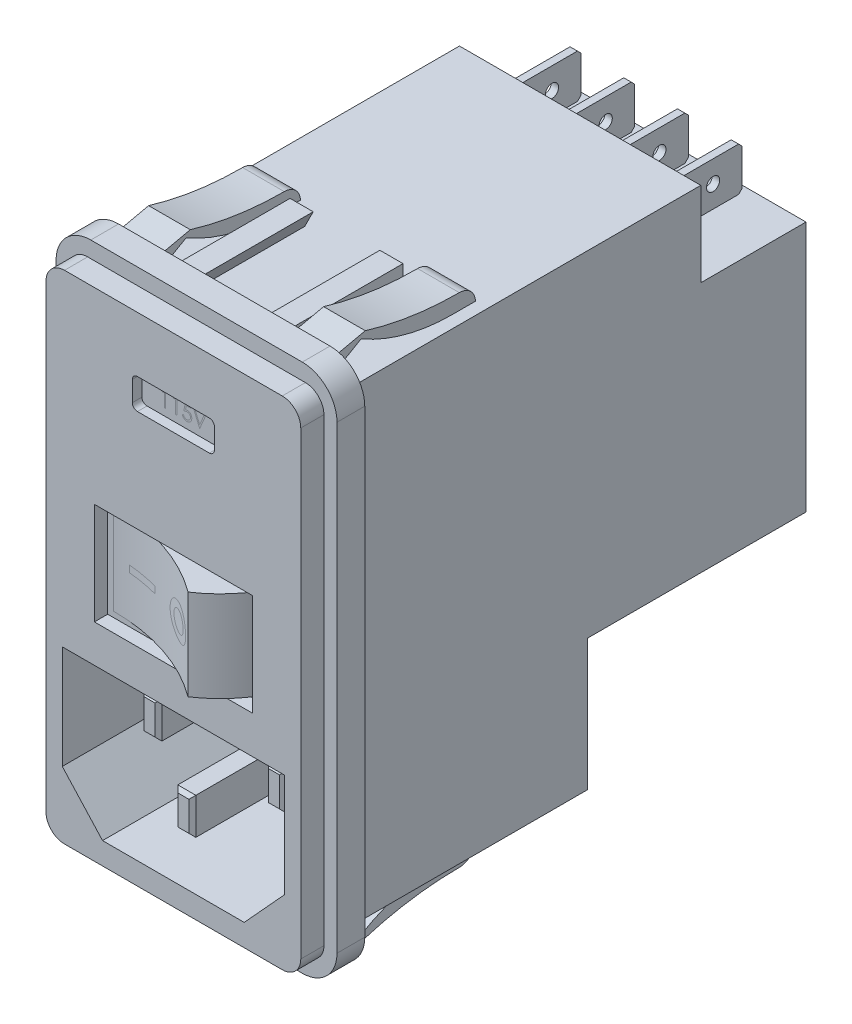
from build123d import *

# Parameters (mm, degrees)
BOSS_EXTRUDE1_DEPTH      = 5.588
CUT_EXTRUDE1_DEPTH       = 2.54
SKETCH4_W                = 26.4795
SKETCH4_H                = 51.2191
BOSS_EXTRUDE2_DEPTH      = 50.5841
CUT_EXTRUDE2_DEPTH       = 16.51
SKETCH5_W                = 1.9812
SKETCH5_H                = 4.0005
BOSS_EXTRUDE3_DEPTH      = 12.3063
SKETCH6_W                = 1.9812
SKETCH6_H                = 4.0005
BOSS_EXTRUDE4_DEPTH      = 15.4178
SKETCH7_W                = 17.3355
SKETCH7_H                = 11.176
CUT_EXTRUDE3_DEPTH       = 1.4605
BOSS_EXTRUDE5_DEPTH      = 4.9784
BOSS_EXTRUDE5_DEPTH_BACK = 4.9784
CUT_EXTRUDE4_DEPTH       = 1.0541
SKETCH10_W               = 11.5443
SKETCH10_H               = 9.2583
SKETCH10_W_2             = 23.9776
SKETCH10_H_2             = 14.4018
CUT_EXTRUDE5_DEPTH       = 70.422139595
SKETCH11_W               = 0.8128
SKETCH11_H               = 4.7879
BOSS_EXTRUDE6_DEPTH      = 8.5217
SKETCH12_R               = 0.7239
CUT_EXTRUDE6_DEPTH       = 68.871292305
BOSS_EXTRUDE7_DEPTH      = 8.4201
SKETCH14_W               = 2.921
SKETCH14_H               = 3.556
BOSS_EXTRUDE8_DEPTH      = 1.524
SKETCH15_W               = 6.5278
SKETCH15_H               = 11.5062
CUT_EXTRUDE7_DEPTH       = 5.0165
SKETCH16_W               = 0.762
SKETCH16_H               = 4.7752
BOSS_EXTRUDE9_DEPTH      = 8.5979
CUT_EXTRUDE8_DEPTH       = 0.762
CHAMFER1_SIZE            = 0.381
BOSS_EXTRUDE10_DEPTH     = 13.4112
BOSS_EXTRUDE11_DEPTH     = 4.572


with BuildPart() as part:
    # Sketch1 → Boss-Extrude1 (new body)
    with BuildSketch(Plane.XY):
        with BuildLine():
            Line((-11.60145, -29.03855), (11.60145, -29.03855))
            ThreePointArc((11.60145, -29.03855), (14.295526836, -27.922626836), (15.41145, -25.22855))
            Line((15.41145, -25.22855), (15.41145, 25.22855))
            ThreePointArc((15.41145, 25.22855), (14.295526836, 27.922626836), (11.60145, 29.03855))
            Line((11.60145, 29.03855), (-11.60145, 29.03855))
            ThreePointArc((-11.60145, 29.03855), (-14.295526836, 27.922626836), (-15.41145, 25.22855))
            Line((-15.41145, 25.22855), (-15.41145, -25.22855))
            ThreePointArc((-15.41145, -25.22855), (-14.295526836, -27.922626836), (-11.60145, -29.03855))
        make_face()
    extrude(amount=-BOSS_EXTRUDE1_DEPTH)

    # Sketch2 → Cut-Extrude1 (cut)
    with BuildSketch(Plane.XY):
        with BuildLine():
            Line((-11.60145, -29.03855), (11.60145, -29.03855))
            ThreePointArc((11.60145, -29.03855), (14.295526836, -27.922626836), (15.41145, -25.22855))
            Line((15.41145, -25.22855), (15.41145, 25.22855))
            ThreePointArc((15.41145, 25.22855), (14.295526836, 27.922626836), (11.60145, 29.03855))
            Line((11.60145, 29.03855), (-11.60145, 29.03855))
            ThreePointArc((-11.60145, 29.03855), (-14.295526836, 27.922626836), (-15.41145, 25.22855))
            Line((-15.41145, 25.22855), (-15.41145, -25.22855))
            ThreePointArc((-15.41145, -25.22855), (-14.295526836, -27.922626836), (-11.60145, -29.03855))
        make_face()
        with BuildLine():
            Line((-11.94435, -27.26055), (11.94435, -27.26055))
            ThreePointArc((11.94435, -27.26055), (13.381190979, -26.665390979), (13.97635, -25.22855))
            Line((13.97635, -25.22855), (13.97635, 25.22855))
            ThreePointArc((13.97635, 25.22855), (13.381190979, 26.665390979), (11.94435, 27.26055))
            Line((11.94435, 27.26055), (-11.94435, 27.26055))
            ThreePointArc((-11.94435, 27.26055), (-13.381190979, 26.665390979), (-13.97635, 25.22855))
            Line((-13.97635, 25.22855), (-13.97635, -25.22855))
            ThreePointArc((-13.97635, -25.22855), (-13.381190979, -26.665390979), (-11.94435, -27.26055))
        make_face(mode=Mode.SUBTRACT)
    extrude(amount=-CUT_EXTRUDE1_DEPTH, mode=Mode.SUBTRACT)

    # Sketch4 → Boss-Extrude2 (add)
    with BuildSketch(Plane(origin=(0, 0, -5.588), x_dir=(-1, 0, 0), z_dir=(0, 0, -1))):
        Rectangle(SKETCH4_W, SKETCH4_H)
    extrude(amount=BOSS_EXTRUDE2_DEPTH)

    # Sketch3 → Cut-Extrude2 (cut)
    with BuildSketch(Plane.XY):
        Polygon((-12.192, -20.00885), (-7.7724, -24.84755), (7.7724, -24.84755), (12.192, -20.00885), (12.192, -8.64235), (-12.192, -8.64235), align=None)
    extrude(amount=-CUT_EXTRUDE2_DEPTH, mode=Mode.SUBTRACT)

    # Sketch5 → Boss-Extrude3 (add)
    with BuildSketch(Plane.XY.offset(-16.51)):
        with Locations((-6.8326, -14.7193)):
            Rectangle(SKETCH5_W, SKETCH5_H)
        with Locations((6.8326, -14.7193)):
            Rectangle(SKETCH5_W, SKETCH5_H)
    extrude(amount=BOSS_EXTRUDE3_DEPTH)

    # Sketch6 → Boss-Extrude4 (add)
    with BuildSketch(Plane.XY.offset(-16.51)):
        with Locations((0, -18.8976)):
            Rectangle(SKETCH6_W, SKETCH6_H)
    extrude(amount=BOSS_EXTRUDE4_DEPTH)

    # Sketch7 → Cut-Extrude3 (cut)
    with BuildSketch(Plane.XY):
        with Locations((0, 1.07315)):
            Rectangle(SKETCH7_W, SKETCH7_H)
    extrude(amount=-CUT_EXTRUDE3_DEPTH, mode=Mode.SUBTRACT)

    # Sketch8 → Boss-Extrude5 (add, two sides: drawn at the far end of the back side and taken through both)
    with BuildSketch(Plane(origin=(0, 1.07315, 0), x_dir=(-1, 0, 0), z_dir=(0, -1, 0)).offset(-BOSS_EXTRUDE5_DEPTH_BACK)):
        with BuildLine():
            Line((8.05815, 1.4605), (-8.05815, 1.4605))
            ThreePointArc((-8.05815, 1.4605), (-6.353679299, -0.780455665), (-4.19735, -2.5908))
            ThreePointArc((-4.19735, -2.5908), (1.604269153, 0.42142137), (8.05815, 1.4605))
        make_face()
    extrude(amount=BOSS_EXTRUDE5_DEPTH + BOSS_EXTRUDE5_DEPTH_BACK)

    # Sketch9 → Cut-Extrude4 (cut)
    with BuildSketch(Plane.XY):
        with BuildLine():
            Line((-3.9497, 17.83715), (3.9497, 17.83715))
            ThreePointArc((3.9497, 17.83715), (4.344831269, 18.000818731), (4.5085, 18.39595))
            Line((4.5085, 18.39595), (4.5085, 20.60575))
            ThreePointArc((4.5085, 20.60575), (4.344831269, 21.000881269), (3.9497, 21.16455))
            Line((3.9497, 21.16455), (-3.9497, 21.16455))
            ThreePointArc((-3.9497, 21.16455), (-4.344831269, 21.000881269), (-4.5085, 20.60575))
            Line((-4.5085, 20.60575), (-4.5085, 18.39595))
            ThreePointArc((-4.5085, 18.39595), (-4.344831269, 18.000818731), (-3.9497, 17.83715))
        make_face()
    extrude(amount=-CUT_EXTRUDE4_DEPTH, mode=Mode.SUBTRACT)

    # Sketch10 → Cut-Extrude5 (cut, through all)
    with BuildSketch(Plane(origin=(13.23975, 0, 0), x_dir=(0, 0, -1), z_dir=(1, 0, 0))):
        with Locations((50.39995, 20.9804)):
            Rectangle(SKETCH10_W, SKETCH10_H)
        with Locations((44.1833, -18.40865)):
            Rectangle(SKETCH10_W_2, SKETCH10_H_2)
    extrude(amount=-CUT_EXTRUDE5_DEPTH, mode=Mode.SUBTRACT)

    # Sketch11 → Boss-Extrude6 (add)
    with BuildSketch(Plane(origin=(0, 0, -44.6278), x_dir=(-1, 0, 0), z_dir=(0, 0, -1))):
        with Locations((-8.8392, 21.0693)):
            Rectangle(SKETCH11_W, SKETCH11_H)
        with Locations((-2.9464, 21.0693)):
            Rectangle(SKETCH11_W, SKETCH11_H)
        with Locations((2.9464, 21.0693)):
            Rectangle(SKETCH11_W, SKETCH11_H)
        with Locations((8.8392, 21.0693)):
            Rectangle(SKETCH11_W, SKETCH11_H)
    extrude(amount=BOSS_EXTRUDE6_DEPTH)

    # Sketch12 → Cut-Extrude6 (cut, through all)
    with BuildSketch(Plane(origin=(9.2456, 0, 0), x_dir=(0, 0, -1), z_dir=(1, 0, 0))):
        with Locations((49.9745, 21.0693)):
            Circle(SKETCH12_R)
    extrude(amount=-CUT_EXTRUDE6_DEPTH, mode=Mode.SUBTRACT)

    # Sketch13 → Boss-Extrude7 (add)
    with BuildSketch(Plane(origin=(0, 0, -32.1945), x_dir=(-1, 0, 0), z_dir=(0, 0, -1))):
        Polygon((-5.69595, -11.20775), (5.69595, -11.20775), (6.9469, -14.10335), (-6.9469, -14.10335), align=None)
    extrude(amount=BOSS_EXTRUDE7_DEPTH)

    # Sketch14 → Boss-Extrude8 (add)
    # profile 1 of 2: a face of its own
    with BuildSketch(Plane(origin=(0, 0, -32.1945), x_dir=(-1, 0, 0), z_dir=(0, 0, -1))):
        with BuildLine():
            Line((-9.49325, -18.37055), (-6.36905, -18.37055))
            ThreePointArc((-6.36905, -18.37055), (-5.902076682, -18.563976682), (-5.70865, -19.03095))
            Line((-5.70865, -19.03095), (-5.70865, -22.79015))
            ThreePointArc((-5.70865, -22.79015), (-5.902076682, -23.257123318), (-6.36905, -23.45055))
            Line((-6.36905, -23.45055), (-9.49325, -23.45055))
            ThreePointArc((-9.49325, -23.45055), (-9.960223318, -23.257123318), (-10.15365, -22.79015))
            Line((-10.15365, -22.79015), (-10.15365, -19.03095))
            ThreePointArc((-10.15365, -19.03095), (-9.960223318, -18.563976682), (-9.49325, -18.37055))
        make_face()
        with Locations((-7.93115, -20.91055)):
            Rectangle(SKETCH14_W, SKETCH14_H, mode=Mode.SUBTRACT)
    # profile 2 of 2: a face of its own
    with BuildSketch(Plane(origin=(0, 0, -32.1945), x_dir=(-1, 0, 0), z_dir=(0, 0, -1))):
        with BuildLine():
            Line((5.70865, -19.03095), (5.70865, -22.79015))
            ThreePointArc((5.70865, -22.79015), (5.902076682, -23.257123318), (6.36905, -23.45055))
            Line((6.36905, -23.45055), (9.49325, -23.45055))
            ThreePointArc((9.49325, -23.45055), (9.960223318, -23.257123318), (10.15365, -22.79015))
            Line((10.15365, -22.79015), (10.15365, -19.03095))
            ThreePointArc((10.15365, -19.03095), (9.960223318, -18.563976682), (9.49325, -18.37055))
            Line((9.49325, -18.37055), (6.36905, -18.37055))
            ThreePointArc((6.36905, -18.37055), (5.902076682, -18.563976682), (5.70865, -19.03095))
        make_face()
        with Locations((7.93115, -20.91055)):
            Rectangle(SKETCH14_W, SKETCH14_H, mode=Mode.SUBTRACT)
    extrude(amount=BOSS_EXTRUDE8_DEPTH)

    # Sketch15 → Cut-Extrude7 (cut)
    with BuildSketch(Plane(origin=(0, 0, -32.1945), x_dir=(-1, 0, 0), z_dir=(0, 0, -1))):
        with Locations((0, -19.85645)):
            Rectangle(SKETCH15_W, SKETCH15_H)
    extrude(amount=-CUT_EXTRUDE7_DEPTH, mode=Mode.SUBTRACT)

    # Sketch16 → Boss-Extrude9 (add)
    with BuildSketch(Plane(origin=(0, 0, -27.178), x_dir=(-1, 0, 0), z_dir=(0, 0, -1))):
        with Locations((0, -18.14195)):
            Rectangle(SKETCH16_W, SKETCH16_H)
    extrude(amount=BOSS_EXTRUDE9_DEPTH)

    # Sketch17 → Cut-Extrude8 (cut)
    with BuildSketch(Plane(origin=(0.381, 0, 0), x_dir=(0, 0, -1), z_dir=(1, 0, 0))):
        with BuildLine():
            Line((31.3944, -18.84045), (32.5374, -18.84045))
            ThreePointArc((32.5374, -18.84045), (33.2359, -18.14195), (32.5374, -17.44345))
            Line((32.5374, -17.44345), (31.3944, -17.44345))
            ThreePointArc((31.3944, -17.44345), (30.6959, -18.14195), (31.3944, -18.84045))
        make_face()
    extrude(amount=-CUT_EXTRUDE8_DEPTH, mode=Mode.SUBTRACT)

    # Chamfer1
    chamfer1_edges = [part.edges().sort_by_distance(p)[0] for p in [
        (-7.8232, -14.7193, -4.2037),
        (-6.8326, -16.71955, -4.2037),
        (-5.842, -14.7193, -4.2037),
        (-6.8326, -12.71905, -4.2037),
        (5.842, -14.7193, -4.2037),
        (6.8326, -16.71955, -4.2037),
        (7.8232, -14.7193, -4.2037),
        (6.8326, -12.71905, -4.2037),
        (-0.9906, -18.8976, -1.0922),
        (0, -20.89785, -1.0922),
        (0.9906, -18.8976, -1.0922),
        (0, -16.89735, -1.0922),
        (8.8392, 23.46325, -53.1495),
        (8.8392, 18.67535, -53.1495),
        (2.9464, 23.46325, -53.1495),
        (2.9464, 18.67535, -53.1495),
        (-2.9464, 23.46325, -53.1495),
        (-2.9464, 18.67535, -53.1495),
        (-8.8392, 23.46325, -53.1495),
        (-8.8392, 18.67535, -53.1495),
        (0, -15.75435, -35.7759),
        (0, -20.52955, -35.7759),
    ]]
    chamfer(chamfer1_edges, length=CHAMFER1_SIZE)

    # Sketch18 → Boss-Extrude10 (add)
    with BuildSketch(Plane(origin=(0, 0, -5.588), x_dir=(-1, 0, 0), z_dir=(0, 0, -1))):
        Polygon((-6.1976, 25.60955), (-4.5847, 25.60955), (-3.6576, 27.46375), (-6.1976, 27.46375), align=None)
        Polygon((3.6576, 27.46375), (4.5847, 25.60955), (6.1976, 25.60955), (6.1976, 27.46375), align=None)
        Polygon((6.1976, -25.60955), (4.5847, -25.60955), (3.6576, -27.46375), (6.1976, -27.46375), align=None)
        Polygon((-3.6576, -27.46375), (-4.5847, -25.60955), (-6.1976, -25.60955), (-6.1976, -27.46375), align=None)
    extrude(amount=BOSS_EXTRUDE10_DEPTH)

    # Sketch19 → Boss-Extrude11 (add)
    with BuildSketch(Plane(origin=(7.3152, 0, 0), x_dir=(0, 0, -1), z_dir=(1, 0, 0))):
        with BuildLine():
            Line((21.2598, 25.60955), (18.7198, 25.60955))
            ThreePointArc((18.7198, 25.60955), (13.538075492, 26.29440796), (8.7122, 28.30195))
            Line((8.7122, 28.30195), (6.5786, 27.07005))
            Line((6.5786, 27.07005), (6.0198, 28.14955))
            Line((6.0198, 28.14955), (9.1694, 28.84805))
            ThreePointArc((9.1694, 28.84805), (14.26866657, 27.697634335), (19.4818, 27.31135))
            ThreePointArc((19.4818, 27.31135), (20.712390025, 26.817335101), (21.2598, 25.60955))
        make_face()
        with BuildLine():
            Line((6.0198, -28.14955), (9.1694, -28.84805))
            ThreePointArc((9.1694, -28.84805), (14.26866657, -27.697634335), (19.4818, -27.31135))
            ThreePointArc((19.4818, -27.31135), (20.712390025, -26.817335101), (21.2598, -25.60955))
            Line((21.2598, -25.60955), (18.7198, -25.60955))
            ThreePointArc((18.7198, -25.60955), (13.538075492, -26.29440796), (8.7122, -28.30195))
            Line((8.7122, -28.30195), (6.5786, -27.07005))
            Line((6.5786, -27.07005), (6.0198, -28.14955))
        make_face()
    boss_extrude11 = extrude(amount=BOSS_EXTRUDE11_DEPTH)

    # Mirror1: Boss-Extrude11 across plane
    add(boss_extrude11.mirror(Plane(origin=(0, 0, 0), x_dir=(0, 0, 1), z_dir=(1, 0, 0))))


solid = part.part
